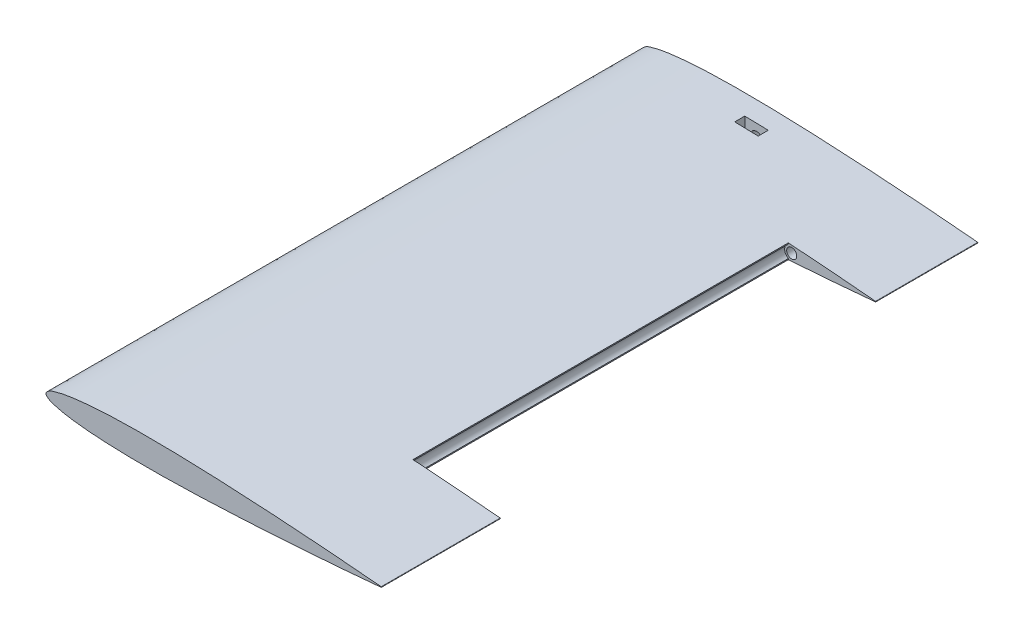
from build123d import *

# Parameters (mm, degrees)
FOAMBASSA_DEPTH                = 30.5
FOAMMEDIA_DEPTH                = 112
SCHIZZO4_W                     = 1
SCHIZZO4_H                     = 4.352344546
SMUSSOPARTEMOBILE_DEPTH        = 112
FOAMALTA_DEPTH                 = 35.5
FOROPERNORUDDEVATOR_DEPTH      = 142.5
FOROPERNORUDDEVATOR_DEPTH_BACK = 179.294882462
SCHIZZO5_R                     = 1.5
SCHIZZO8_R                     = 3
FOROLONGHERONE_DEPTH           = 173
AGGANCIOLONGHERONE_DEPTH       = 5
SCHIZZO10_R                    = 1.75
FOROVITEBASE_DEPTH             = 13
INTAGLIODADO_DEPTH             = 3
INTAGLIOSERVOMOTORE_DEPTH      = 1
INTAGLIOSERVOMOTORE_DEPTH_BACK = 10
SCHIZZO12_W                    = 25
SCHIZZO12_H                    = 36


with BuildPart() as part:
    # Schizzo1 → FoamBassa (new body)
    with BuildSketch(Plane.XY):
        with BuildLine():
            ThreePointArc((100, 0.084), (100.084, 0), (100, -0.084))
            add(Edge.make_bspline(
                [(100, 0.084), (98.333488815, 0.23674648), (95.001194725, 0.542172689), (88.335559621, 1.11089898), (80.003293356, 1.763610995), (70.002998933, 2.457861693), (60.003104625, 3.061747723), (50.003008601, 3.552139212), (40.002598558, 3.902946494), (31.666961486, 4.025260151), (24.9991546, 3.976933791), (19.997775587, 3.844976398), (14.993363131, 3.592486959), (10.827184065, 3.237651579), (7.489054388, 2.814021367), (4.99359465, 2.403673059), (2.84962634, 1.867925494), (1.165413503, 1.320987252), (-0.664613784, 0), (1.165413503, -1.320987252), (2.84962634, -1.867925494), (4.99359465, -2.403673059), (7.489054388, -2.814021367), (10.827184065, -3.237651579), (14.993363131, -3.592486959), (19.997775587, -3.844976398), (24.9991546, -3.976933791), (31.666961486, -4.025260151), (40.002598558, -3.902946494), (50.003008601, -3.552139212), (60.003104625, -3.061747723), (70.002998933, -2.457861693), (80.003293356, -1.763610995), (88.335559621, -1.11089898), (95.001194725, -0.542172689), (98.333488815, -0.23674648), (100, -0.084)],
                knots=[0, 0, 0, 0, 0.024876293, 0.049741715, 0.099443402, 0.149112224, 0.198750974, 0.248359097, 0.29793737, 0.347491327, 0.37226694, 0.397050924, 0.421859475, 0.446731346, 0.459220451, 0.471790602, 0.484560454, 0.491195112, 0.5, 0.508804888, 0.515439546, 0.528209398, 0.540779549, 0.553268654, 0.578140525, 0.602949076, 0.62773306, 0.652508673, 0.70206263, 0.751640903, 0.801249026, 0.850887776, 0.900556598, 0.950258285, 0.975123707, 1, 1, 1, 1], degree=3))
        make_face()
    extrude(amount=FOAMBASSA_DEPTH)

    # Schizzo2 → FoamMedia (add)
    with BuildSketch(Plane.XY.offset(30.5)):
        with BuildLine():
            ThreePointArc((75, 2.107216055), (72.892783944, 0), (75, -2.107216055))
            add(Edge.make_bspline(
                [(75, 2.107216055), (73.333587352, 2.222873526), (68.33507528, 2.558586337), (60.003104625, 3.061747723), (50.003008601, 3.552139212), (40.002598558, 3.902946494), (31.666961486, 4.025260151), (24.9991546, 3.976933791), (19.997775587, 3.844976398), (14.993363131, 3.592486959), (10.827184065, 3.237651579), (7.489054388, 2.814021367), (4.99359465, 2.403673059), (2.84962634, 1.867925494), (1.165413503, 1.320987252), (-0.664613784, 0), (1.165413503, -1.320987252), (2.84962634, -1.867925494), (4.99359465, -2.403673059), (7.489054388, -2.814021367), (10.827184065, -3.237651579), (14.993363131, -3.592486959), (19.997775587, -3.844976398), (24.9991546, -3.976933791), (31.666961486, -4.025260151), (40.002598558, -3.902946494), (50.003008601, -3.552139212), (60.003104625, -3.061747723), (68.33507528, -2.558586337), (73.333587352, -2.222873526), (75, -2.107216055)],
                knots=[0.124281666, 0.124281666, 0.124281666, 0.124281666, 0.149112224, 0.198750974, 0.248359097, 0.29793737, 0.347491327, 0.37226694, 0.397050924, 0.421859475, 0.446731346, 0.459220451, 0.471790602, 0.484560454, 0.491195112, 0.5, 0.508804888, 0.515439546, 0.528209398, 0.540779549, 0.553268654, 0.578140525, 0.602949076, 0.62773306, 0.652508673, 0.70206263, 0.751640903, 0.801249026, 0.850887776, 0.875718334, 0.875718334, 0.875718334, 0.875718334], degree=3))
        make_face()
    extrude(amount=FOAMMEDIA_DEPTH)

    # Schizzo4 → SmussoParteMobile (cut)
    with BuildSketch(Plane.XY.offset(142.5)):
        with Locations((74.5, 0)):
            Rectangle(SCHIZZO4_W, SCHIZZO4_H)
    extrude(amount=-SMUSSOPARTEMOBILE_DEPTH, mode=Mode.SUBTRACT)

    # Schizzo6 → FoamAlta (add)
    with BuildSketch(Plane.XY.offset(142.5)):
        with BuildLine():
            ThreePointArc((100, 0.084), (100.084, 0), (100, -0.084))
            add(Edge.make_bspline(
                [(100, 0.084), (98.333488815, 0.23674648), (95.001194725, 0.542172689), (88.335559621, 1.11089898), (80.003293356, 1.763610995), (70.002998933, 2.457861693), (60.003104625, 3.061747723), (50.003008601, 3.552139212), (40.002598558, 3.902946494), (31.666961486, 4.025260151), (24.9991546, 3.976933791), (19.997775587, 3.844976398), (14.993363131, 3.592486959), (10.827184065, 3.237651579), (7.489054388, 2.814021367), (4.99359465, 2.403673059), (2.84962634, 1.867925494), (1.165413503, 1.320987252), (-0.664613784, 0), (1.165413503, -1.320987252), (2.84962634, -1.867925494), (4.99359465, -2.403673059), (7.489054388, -2.814021367), (10.827184065, -3.237651579), (14.993363131, -3.592486959), (19.997775587, -3.844976398), (24.9991546, -3.976933791), (31.666961486, -4.025260151), (40.002598558, -3.902946494), (50.003008601, -3.552139212), (60.003104625, -3.061747723), (70.002998933, -2.457861693), (80.003293356, -1.763610995), (88.335559621, -1.11089898), (95.001194725, -0.542172689), (98.333488815, -0.23674648), (100, -0.084)],
                knots=[0, 0, 0, 0, 0.024876293, 0.049741715, 0.099443402, 0.149112224, 0.198750974, 0.248359097, 0.29793737, 0.347491327, 0.37226694, 0.397050924, 0.421859475, 0.446731346, 0.459220451, 0.471790602, 0.484560454, 0.491195112, 0.5, 0.508804888, 0.515439546, 0.528209398, 0.540779549, 0.553268654, 0.578140525, 0.602949076, 0.62773306, 0.652508673, 0.70206263, 0.751640903, 0.801249026, 0.850887776, 0.900556598, 0.950258285, 0.975123707, 1, 1, 1, 1], degree=3))
        make_face()
    extrude(amount=FOAMALTA_DEPTH)

    # Schizzo5 → ForoPernoRuddevator (cut, two sides: drawn at the far end of the back side and taken through both)
    with BuildSketch(Plane.XY.offset(30.5).offset(-FOROPERNORUDDEVATOR_DEPTH_BACK)):
        with Locations((75, 0)):
            Circle(SCHIZZO5_R)
    extrude(amount=FOROPERNORUDDEVATOR_DEPTH + FOROPERNORUDDEVATOR_DEPTH_BACK, mode=Mode.SUBTRACT)

    # Schizzo8 → ForoLongherone (cut)
    with BuildSketch(Plane(origin=(0, 0, 0), x_dir=(-1, 0, 0), z_dir=(0, 0, -1))):
        with Locations((-25, 0)):
            Circle(SCHIZZO8_R)
    extrude(amount=-FOROLONGHERONE_DEPTH, mode=Mode.SUBTRACT)

    # Schizzo9 → AggancioLongherone (cut)
    with BuildSketch(Plane(origin=(0, 0, 0), x_dir=(-1, 0, 0), z_dir=(0, 0, -1))):
        with BuildLine():
            Line((-27.645751311, 3), (-22.354248689, 3))
            ThreePointArc((-22.354248689, 3), (-21, 0), (-22.354248689, -3))
            Line((-22.354248689, -3), (-27.645751311, -3))
            ThreePointArc((-27.645751311, -3), (-29, 0), (-27.645751311, 3))
        make_face()
    extrude(amount=-AGGANCIOLONGHERONE_DEPTH, mode=Mode.SUBTRACT)

    # Schizzo10 → ForoViteBase (cut)
    with BuildSketch(Plane(origin=(0, 0, 0), x_dir=(-1, 0, 0), z_dir=(0, 0, -1))):
        with Locations((-40, 0)):
            Circle(SCHIZZO10_R)
    extrude(amount=-FOROVITEBASE_DEPTH, mode=Mode.SUBTRACT)

    # Schizzo11 → IntaglioDado (cut)
    with BuildSketch(Plane(origin=(0, 0, 6), x_dir=(-1, 0, 0), z_dir=(0, 0, -1))):
        Polygon((-43.5, 0), (-43.5, 5), (-36.5, 5), (-36.5, 0), (-38.25, -3.031088913), (-41.75, -3.031088913), align=None)
    extrude(amount=-INTAGLIODADO_DEPTH, mode=Mode.SUBTRACT)

    # Schizzo12 → IntaglioServomotore (cut, two sides: drawn at the far end of the back side and taken through both)
    with BuildSketch(Plane(origin=(0, 0, 0), x_dir=(1, 0, 0), z_dir=(0, 1, 0)).offset(-INTAGLIOSERVOMOTORE_DEPTH_BACK)):
        with Locations((44, -38)):
            Rectangle(SCHIZZO12_W, SCHIZZO12_H)
    extrude(amount=INTAGLIOSERVOMOTORE_DEPTH + INTAGLIOSERVOMOTORE_DEPTH_BACK, mode=Mode.SUBTRACT)


solid = part.part
